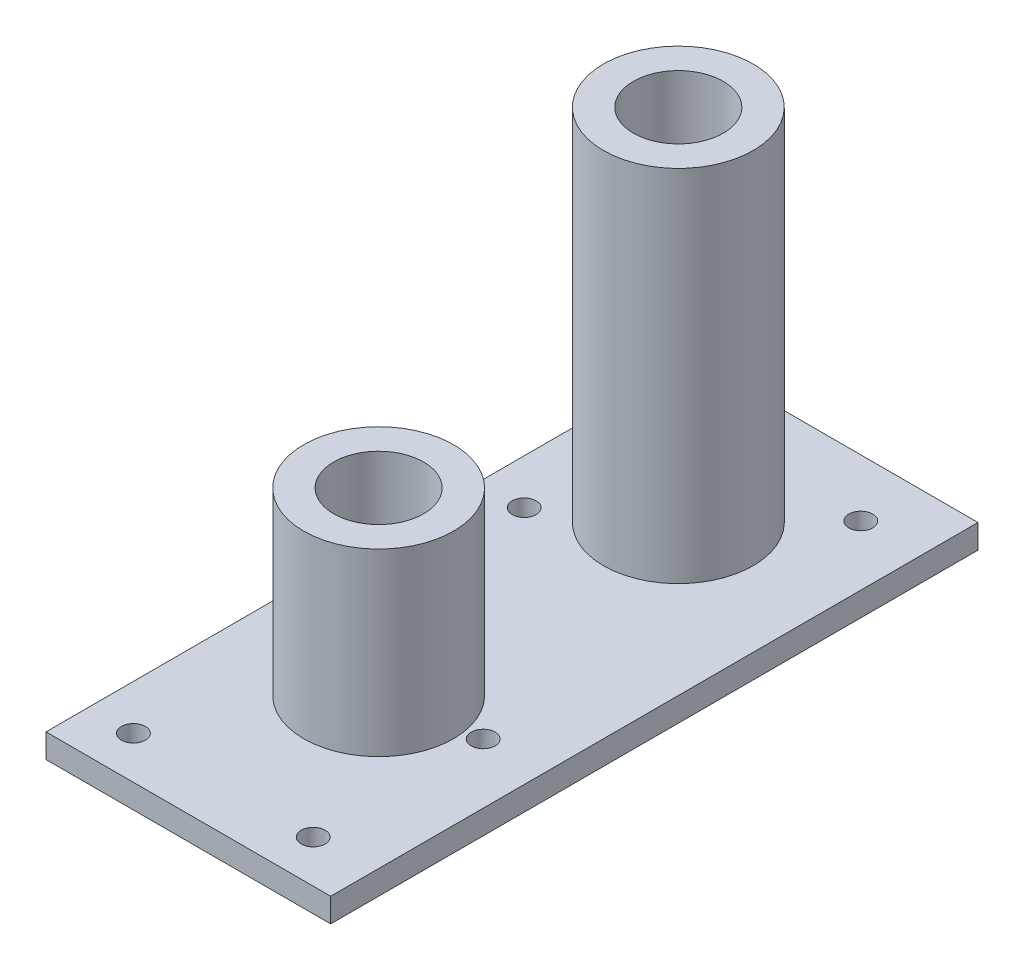
from build123d import *

# Parameters (mm, degrees)
SKETCH1_W           = 47.5
SKETCH1_H           = 108
SKETCH1_R           = 2
SKETCH1_W_2         = 10
SKETCH1_H_2         = 10
BOSS_EXTRUDE1_DEPTH = 4
SKETCH2_R           = 12.5
SKETCH2_R_2         = 7.5
BOSS_EXTRUDE2_DEPTH = 30
SKETCH4_R           = 12.5
SKETCH4_R_2         = 7.5
BOSS_EXTRUDE3_DEPTH = 60


with BuildPart() as part:
    # Sketch1 → Boss-Extrude1 (new body)
    with BuildSketch(Plane(origin=(0, 0, 0), x_dir=(1, 0, 0), z_dir=(0, 1, 0))):
        with Locations((-12.897727273, -27.125)):
            Rectangle(SKETCH1_W, SKETCH1_H)
        with Locations(Location((0.852272727, 17.315, 0), (0, 0, 270))):
            Circle(SKETCH1_R, mode=Mode.SUBTRACT)
        with Locations(Location((-29.147727273, -8.845, 0), (0, 0, 270))):
            Circle(SKETCH1_R, mode=Mode.SUBTRACT)
        with Locations(Location((0.852272727, -45.685, 0), (0, 0, 270))):
            Circle(SKETCH1_R, mode=Mode.SUBTRACT)
        with Locations(Location((0.852272727, -74.045, 0), (0, 0, 270))):
            Circle(SKETCH1_R, mode=Mode.SUBTRACT)
        with Locations(Location((-29.147727273, -74.045, 0), (0, 0, 270))):
            Circle(SKETCH1_R, mode=Mode.SUBTRACT)
        with Locations((-14.147727273, 1.875)):
            Rectangle(SKETCH1_W_2, SKETCH1_H_2, mode=Mode.SUBTRACT)
        with Locations((-14.147727273, -48.125)):
            Rectangle(SKETCH1_W_2, SKETCH1_H_2, mode=Mode.SUBTRACT)
    extrude(amount=-BOSS_EXTRUDE1_DEPTH)

    # Sketch2 → Boss-Extrude2 (add)
    with BuildSketch(Plane(origin=(0, 0, 0), x_dir=(1, 0, 0), z_dir=(0, 1, 0))):
        with Locations(Location((-14.147727273, -48.125, 0), (0, 0, 270))):
            Circle(SKETCH2_R)
        with Locations(Location((-14.147727273, -48.125, 0), (0, 0, 270))):
            Circle(SKETCH2_R_2, mode=Mode.SUBTRACT)
    extrude(amount=BOSS_EXTRUDE2_DEPTH)

    # Sketch4 → Boss-Extrude3 (add)
    with BuildSketch(Plane(origin=(0, 0, 0), x_dir=(1, 0, 0), z_dir=(0, 1, 0))):
        with Locations(Location((-14.147727273, 1.875, 0), (0, 0, 270))):
            Circle(SKETCH4_R)
        with Locations(Location((-14.147727273, 1.875, 0), (0, 0, 270))):
            Circle(SKETCH4_R_2, mode=Mode.SUBTRACT)
    extrude(amount=BOSS_EXTRUDE3_DEPTH)


solid = part.part
